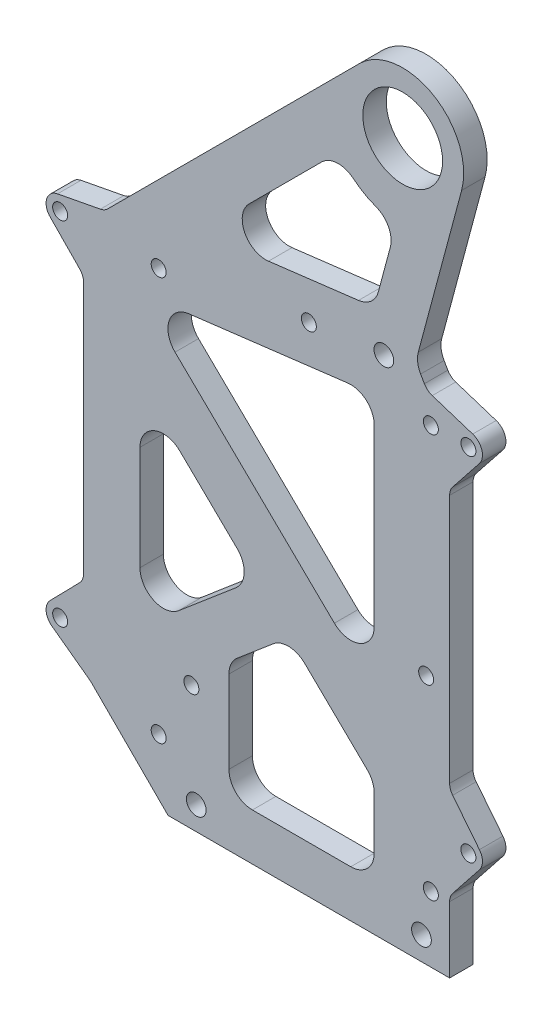
from build123d import *

# Parameters (mm, degrees)
SKETCH1_W             = 80
SKETCH1_H             = 180
SKETCH1_R             = 8.5
BOSS_EXTRUDE1_DEPTH   = 5
SKETCH2_R             = 5.5
CUT_EXTRUDE1_DEPTH    = 30
SKETCH3_R             = 1.6
SKETCH3_R_2           = 2.5
CUT_EXTRUDE2_DEPTH    = 5
CUT_EXTRUDE3_DEPTH    = 10
BOSS_EXTRUDE2_DEPTH   = 5
FILLET1_R             = 2
FILLET2_R             = 5
SKETCH6_R             = 2.1
CUT_EXTRUDE4_DEPTH    = 5
SKETCH7_W             = 58.3648838
SKETCH7_H             = 19.178580611
BOSS_EXTRUDE3_DEPTH   = 5
SKETCH8_R             = 2.1
CUT_EXTRUDE5_DEPTH    = 5
SKETCH9_R             = 1.6
CUT_EXTRUDE6_DEPTH    = 5
SKETCH10_R            = 3
SKETCH10_R_2          = 1.6
BOSS_EXTRUDE4_DEPTH   = 5
BOSS_EXTRUDE4_2_DEPTH = 5
BOSS_EXTRUDE4_3_DEPTH = 5
BOSS_EXTRUDE4_4_DEPTH = 5
SKETCH11_R            = 5.5
BOSS_EXTRUDE5_DEPTH   = 5
FILLET3_R             = 3
CUT_EXTRUDE7_DEPTH    = 5
FILLET5_R             = 5


with BuildPart() as part:
    # Sketch1 → Boss-Extrude1 (new body)
    with BuildSketch(Plane.XY):
        with Locations((10, 166)):
            Rectangle(SKETCH1_W, SKETCH1_H)
        with Locations((20, 226)):
            Circle(SKETCH1_R, mode=Mode.SUBTRACT)
    extrude(amount=BOSS_EXTRUDE1_DEPTH)

    # Sketch2 → Cut-Extrude1 (cut)
    with BuildSketch(Plane.XY.offset(5)):
        with Locations((20, 151)):
            Circle(SKETCH2_R)
    extrude(amount=-CUT_EXTRUDE1_DEPTH, mode=Mode.SUBTRACT)

    # Sketch3 → Cut-Extrude2 (cut)
    with BuildSketch(Plane.XY.offset(5)):
        with Locations((0, 182)):
            Circle(SKETCH3_R)
        with Locations((25, 129.301270189)):
            Circle(SKETCH3_R)
        with Locations((-25.032859693, 102.533479235)):
            Circle(SKETCH3_R)
        with Locations((-15, 81)):
            Circle(SKETCH3_R_2)
        with Locations((15, 81)):
            Circle(SKETCH3_R_2)
        with Locations((24, 91)):
            Circle(SKETCH3_R_2)
        with Locations((-24, 91)):
            Circle(SKETCH3_R_2)
    extrude(amount=-CUT_EXTRUDE2_DEPTH, mode=Mode.SUBTRACT)

    # Sketch4 → Cut-Extrude3 (cut)
    with BuildSketch(Plane.XY.offset(5)):
        with BuildLine():
            Line((-30, 194.384776311), (10.807611845, 235.192388155))
            ThreePointArc((10.807611845, 235.192388155), (24.974884621, 238.010433923), (33, 226))
            ThreePointArc((33, 226), (32.888783198, 224.303159501), (32.557035742, 222.635352414))
            Line((32.557035742, 222.635352414), (22.786943589, 186.172872106))
            Line((22.786943589, 186.172872106), (30, 173.679491924))
            Line((30, 173.679491924), (30, 76))
            Line((30, 76), (50, 76))
            Line((50, 76), (50, 256))
            Line((50, 256), (-30, 256))
            Line((-30, 256), (-30, 194.384776311))
        make_face()
    extrude(amount=-CUT_EXTRUDE3_DEPTH, mode=Mode.SUBTRACT)

    # Sketch5 → Boss-Extrude2 (add)
    with BuildSketch(Plane.XY.offset(5)):
        with BuildLine():
            Line((-30, 169.384776311), (-30, 194.384776311))
            Line((-30, 194.384776311), (-46.535533906, 177.849242405))
            ThreePointArc((-46.535533906, 177.849242405), (-47.619397663, 176.227125661), (-48, 174.313708499))
            Line((-48, 174.313708499), (-48, 96.071067812))
            ThreePointArc((-48, 96.071067812), (-47.619397663, 94.15765065), (-46.535533906, 92.535533906))
            Line((-46.535533906, 92.535533906), (-30, 76))
            Line((-30, 76), (-30, 101))
            ThreePointArc((-30, 101), (-35, 96), (-40, 101))
            Line((-40, 101), (-40, 131.707106781))
            Line((-40, 131.707106781), (-30, 121.707106781))
            Line((-30, 121.707106781), (-30, 138.67766953))
            Line((-30, 138.67766953), (-40, 148.67766953))
            Line((-40, 148.67766953), (-40, 169.384776311))
            ThreePointArc((-40, 169.384776311), (-35, 174.384776311), (-30, 169.384776311))
        make_face()
    extrude(amount=-BOSS_EXTRUDE2_DEPTH)

    # Fillet1
    fillet1_edges = [part.edges().sort_by_distance(p)[0] for p in [
        (-40, 131.707106781, 2.5),
        (-40, 148.67766953, 2.5),
        (-30, 121.707106781, 2.5),
        (-30, 138.67766953, 2.5),
    ]]
    fillet(fillet1_edges, radius=FILLET1_R)

    # Fillet2
    fillet2_edges = [part.edges().sort_by_distance(p)[0] for p in [
        (30, 173.679491924, 2.5),
        (22.786943589, 186.172872106, 2.5),
    ]]
    fillet(fillet2_edges, radius=FILLET2_R)

    # Sketch6 → Cut-Extrude4 (cut)
    with BuildSketch(Plane.XY.offset(5)):
        with Locations((15.982125076, 183.959163508)):
            Circle(SKETCH6_R)
    extrude(amount=-CUT_EXTRUDE4_DEPTH, mode=Mode.SUBTRACT)

    # Sketch7 → Boss-Extrude3 (add)
    with BuildSketch(Plane(origin=(0, 0, 0), x_dir=(-1, 0, 0), z_dir=(0, 0, -1))):
        with Locations((-0.8175581, 85.589290306)):
            Rectangle(SKETCH7_W, SKETCH7_H)
    extrude(amount=-BOSS_EXTRUDE3_DEPTH)

    # Sketch8 → Cut-Extrude5 (cut)
    with BuildSketch(Plane(origin=(0, 0, 0), x_dir=(-1, 0, 0), z_dir=(0, 0, -1))):
        with Locations((24, 81)):
            Circle(SKETCH8_R)
        with Locations((-24, 81)):
            Circle(SKETCH8_R)
    extrude(amount=-CUT_EXTRUDE5_DEPTH, mode=Mode.SUBTRACT)

    # Sketch9 → Cut-Extrude6 (cut)
    with BuildSketch(Plane(origin=(0, 0, 0), x_dir=(-1, 0, 0), z_dir=(0, 0, -1))):
        with Locations((-26, 176)):
            Circle(SKETCH9_R)
        with Locations((32, 176)):
            Circle(SKETCH9_R)
        with Locations((-26, 90)):
            Circle(SKETCH9_R)
        with Locations((32, 90)):
            Circle(SKETCH9_R)
    extrude(amount=-CUT_EXTRUDE6_DEPTH, mode=Mode.SUBTRACT)



with BuildPart() as body_2:
    # Sketch10 → Boss-Extrude4 (new body)
    with BuildSketch(Plane(origin=(0, 0, 0), x_dir=(-1, 0, 0), z_dir=(0, 0, -1))):
        with Locations((-34, 176)):
            Circle(SKETCH10_R)
        with Locations((-34, 176)):
            Circle(SKETCH10_R_2, mode=Mode.SUBTRACT)
    extrude(amount=-BOSS_EXTRUDE4_DEPTH)


with BuildPart() as body_3:
    # Sketch10 → Boss-Extrude4 2 (new body)
    with BuildSketch(Plane(origin=(0, 0, 0), x_dir=(-1, 0, 0), z_dir=(0, 0, -1))):
        with Locations((-34, 101)):
            Circle(SKETCH10_R)
        with Locations((-34, 101)):
            Circle(SKETCH10_R_2, mode=Mode.SUBTRACT)
    extrude(amount=-BOSS_EXTRUDE4_2_DEPTH)


with BuildPart() as body_4:
    # Sketch10 → Boss-Extrude4 3 (new body)
    with BuildSketch(Plane(origin=(0, 0, 0), x_dir=(-1, 0, 0), z_dir=(0, 0, -1))):
        with Locations((53, 176)):
            Circle(SKETCH10_R)
        with Locations((53, 176)):
            Circle(SKETCH10_R_2, mode=Mode.SUBTRACT)
    extrude(amount=-BOSS_EXTRUDE4_3_DEPTH)


with BuildPart() as body_5:
    # Sketch10 → Boss-Extrude4 4 (new body)
    with BuildSketch(Plane(origin=(0, 0, 0), x_dir=(-1, 0, 0), z_dir=(0, 0, -1))):
        with Locations((53, 101)):
            Circle(SKETCH10_R)
        with Locations((53, 101)):
            Circle(SKETCH10_R_2, mode=Mode.SUBTRACT)
    extrude(amount=-BOSS_EXTRUDE4_4_DEPTH)


with BuildPart() as part_1:
    add(part.part)

    add(body_2.part)  # Boss-Extrude5 merges body 2

    add(body_3.part)  # Boss-Extrude5 merges body 3

    add(body_4.part)  # Boss-Extrude5 merges body 4

    add(body_5.part)  # Boss-Extrude5 merges body 5
    # Sketch11 → Boss-Extrude5 (add)
    with BuildSketch(Plane(origin=(0, 0, 0), x_dir=(-1, 0, 0), z_dir=(0, 0, -1))):
        with Locations((-20, 151)):
            Circle(SKETCH11_R)
        with BuildLine():
            Line((30, 120.878679656), (30, 101))
            ThreePointArc((30, 101), (35, 96), (40, 101))
            Line((40, 101), (40, 126.878679656))
            ThreePointArc((40, 126.878679656), (38.765366865, 128.726438721), (36.585786438, 128.292893219))
            Line((36.585786438, 128.292893219), (30.585786438, 122.292893219))
            ThreePointArc((30.585786438, 122.292893219), (30.152240935, 121.644046521), (30, 120.878679656))
        make_face()
        with BuildLine():
            Line((40, 169.384776311), (40, 149.506096654))
            ThreePointArc((40, 149.506096654), (39.847759065, 148.74072979), (39.414213562, 148.091883092))
            Line((39.414213562, 148.091883092), (33.414213562, 142.091883092))
            ThreePointArc((33.414213562, 142.091883092), (31.234633135, 141.658337589), (30, 143.506096654))
            Line((30, 143.506096654), (30, 169.384776311))
            ThreePointArc((30, 169.384776311), (35, 174.384776311), (40, 169.384776311))
        make_face()
        with BuildLine():
            Line((53.561989138, 178.946891279), (43.523484359, 180.861291952))
            Line((43.523484359, 180.861291952), (46.535533906, 177.849242405))
            ThreePointArc((46.535533906, 177.849242405), (47.619397663, 176.227125661), (48, 174.313708499))
            Line((48, 174.313708499), (48, 166.595931299))
            Line((48, 166.595931299), (55.144920857, 173.902545705))
            ThreePointArc((55.144920857, 173.902545705), (50.137624065, 175.101777308), (53.561989138, 178.946891279))
        make_face()
        with BuildLine():
            Line((55.144920857, 103.097454295), (48, 110.404068701))
            Line((48, 110.404068701), (48, 96.071067812))
            ThreePointArc((48, 96.071067812), (47.619397663, 94.15765065), (46.535533906, 92.535533906))
            Line((46.535533906, 92.535533906), (54.774786308, 98.581295065))
            ThreePointArc((54.774786308, 98.581295065), (50.010025149, 101.24505181), (55.144920857, 103.097454295))
        make_face()
        with BuildLine():
            Line((-34.922393234, 178.854678742), (-25.198007946, 181.99678614))
            Line((-25.198007946, 181.99678614), (-29.330127019, 174.839745962))
            ThreePointArc((-29.330127019, 174.839745962), (-29.829629131, 173.633841188), (-30, 172.339745962))
            Line((-30, 172.339745962), (-30, 166.12900673))
            Line((-30, 166.12900673), (-36.350455148, 174.135768095))
            ThreePointArc((-36.350455148, 174.135768095), (-31.128604249, 175.1310429), (-34.922393234, 178.854678742))
        make_face()
        with BuildLine():
            Line((-36.350455148, 102.864231905), (-30, 110.87099327))
            Line((-30, 110.87099327), (-30, 91.12900673))
            Line((-30, 91.12900673), (-36.350455148, 99.135768095))
            ThreePointArc((-36.350455148, 99.135768095), (-31, 101), (-36.350455148, 102.864231905))
        make_face()
    extrude(amount=-BOSS_EXTRUDE5_DEPTH)

    # Fillet3
    fillet3_edges = [part_1.edges().sort_by_distance(p)[0] for p in [
        (25.198007946, 181.99678614, 2.5),
        (30, 166.12900673, 2.5),
        (30, 110.87099327, 2.5),
        (30, 91.12900673, 2.5),
        (-46.535533906, 92.535533906, 2.5),
        (-48, 110.404068701, 2.5),
        (-48, 166.595931299, 2.5),
        (-43.523484359, 180.861291952, 2.5),
    ]]
    fillet(fillet3_edges, radius=FILLET3_R)

    # Sketch12 → Cut-Extrude7 (cut)
    with BuildSketch(Plane(origin=(0, 0, 0), x_dir=(-1, 0, 0), z_dir=(0, 0, -1))):
        with BuildLine():
            Line((-18.698443457, 209.551414937), (-13.933365214, 191.767900833))
            Line((-13.933365214, 191.767900833), (23.002512143, 187.240128544))
            Line((23.002512143, 187.240128544), (-6.405885751, 216.648526438))
            ThreePointArc((-6.405885751, 216.648526438), (-11.75, 211.710580838), (-18.698443457, 209.551414937))
        make_face()
        Polygon((-13.933365214, 175.648133085), (-13.933365214, 120.954454576), (36, 169.527068053), align=None)
        Polygon((36, 152.786143643), (11.352419227, 128.810242782), (36, 107.935659547), align=None)
        Polygon((4.150846245, 121.804922404), (-13.933365214, 104.213530166), (-13.933365214, 86), (17.032859693, 86), (17.032859693, 110.894859285), align=None)
    extrude(amount=-CUT_EXTRUDE7_DEPTH, mode=Mode.SUBTRACT)

    # Fillet5
    fillet5_edges = [part_1.edges().sort_by_distance(p)[0] for p in [
        (6.405885751, 216.648526438, 2.5),
        (18.698443457, 209.551414937, 2.5),
        (13.933365214, 191.767900833, 2.5),
        (-23.002512143, 187.240128544, 2.5),
        (-17.032859693, 86, 2.5),
        (-36, 107.935659547, 2.5),
        (13.933365214, 86, 2.5),
        (13.933365214, 120.954454576, 2.5),
        (-36, 169.527068053, 2.5),
        (-4.150846245, 121.804922404, 2.5),
        (-17.032859693, 110.894859285, 2.5),
        (-36, 152.786143643, 2.5),
        (13.933365214, 104.213530166, 2.5),
        (-11.352419227, 128.810242782, 2.5),
        (13.933365214, 175.648133085, 2.5),
    ]]
    fillet(fillet5_edges, radius=FILLET5_R)


solid = part_1.part
